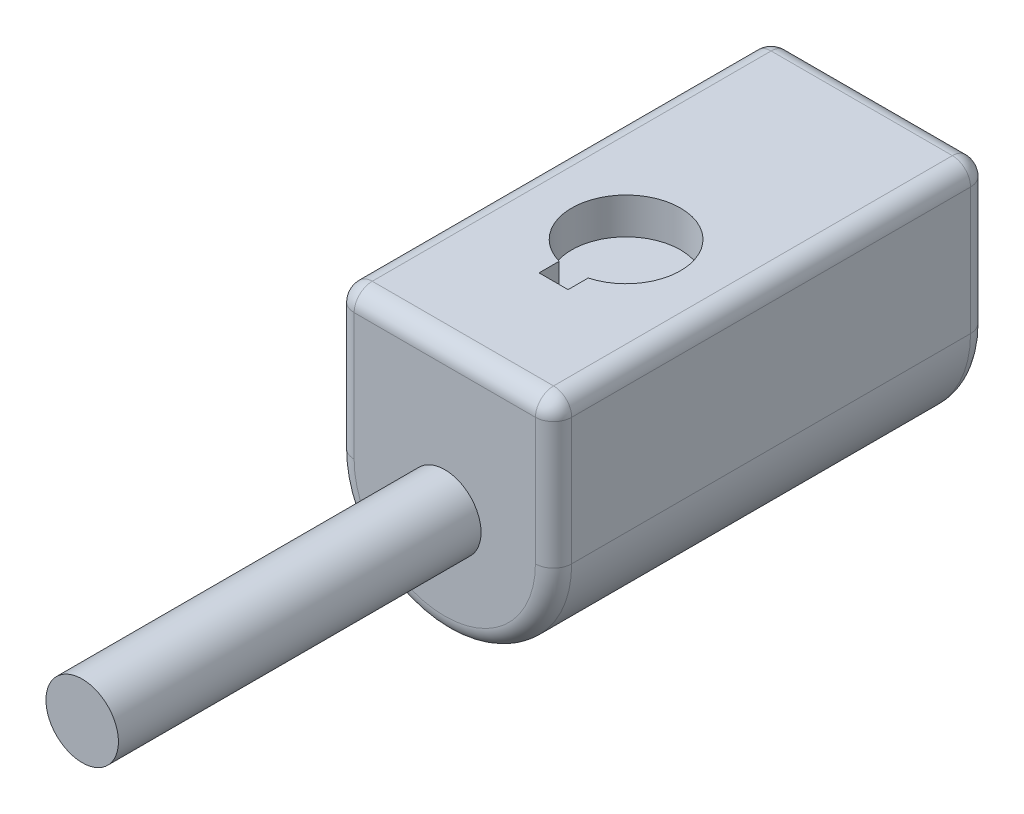
from build123d import *

# Parameters (mm, degrees)
BOSS_EXTRUDE1_DEPTH = 152.4
SKETCH2_R           = 12.7
BOSS_EXTRUDE2_DEPTH = 127
CUT_EXTRUDE1_DEPTH  = 12.7
FILLET1_R           = 6.35


with BuildPart() as part:
    # Sketch1 → Boss-Extrude1 (new body)
    with BuildSketch(Plane.XY):
        with BuildLine():
            Line((-38.1, 0), (-38.1, 50.8))
            Line((-38.1, 50.8), (38.1, 50.8))
            Line((38.1, 50.8), (38.1, 0))
            ThreePointArc((38.1, 0), (0, -38.1), (-38.1, 0))
        make_face()
    extrude(amount=-BOSS_EXTRUDE1_DEPTH)

    # Sketch2 → Boss-Extrude2 (add)
    with BuildSketch(Plane.XY):
        Circle(SKETCH2_R)
    extrude(amount=BOSS_EXTRUDE2_DEPTH)

    # Sketch3 → Cut-Extrude1 (cut)
    with BuildSketch(Plane(origin=(0, 50.8, 0), x_dir=(1, 0, 0), z_dir=(0, 1, 0))):
        with BuildLine():
            Line((5.08, 45.139822986), (5.08, 38.1))
            Line((5.08, 38.1), (-5.08, 38.1))
            Line((-5.08, 38.1), (-5.08, 45.139822986))
            ThreePointArc((-5.08, 45.139822986), (0, 82.55), (5.08, 45.139822986))
        make_face()
    extrude(amount=-CUT_EXTRUDE1_DEPTH, mode=Mode.SUBTRACT)

    # Fillet1
    fillet1_edges = [part.edges().sort_by_distance(p)[0] for p in [
        (0, 50.8, -152.4),
        (-38.1, 25.4, -152.4),
        (0, -38.1, -152.4),
        (-38.1, 25.4, 0),
        (0, 50.8, 0),
        (38.1, 25.4, 0),
        (0, -38.1, 0),
        (38.1, 25.4, -152.4),
        (-38.1, 50.8, -76.2),
        (38.1, 50.8, -76.2),
    ]]
    fillet(fillet1_edges, radius=FILLET1_R)


solid = part.part
